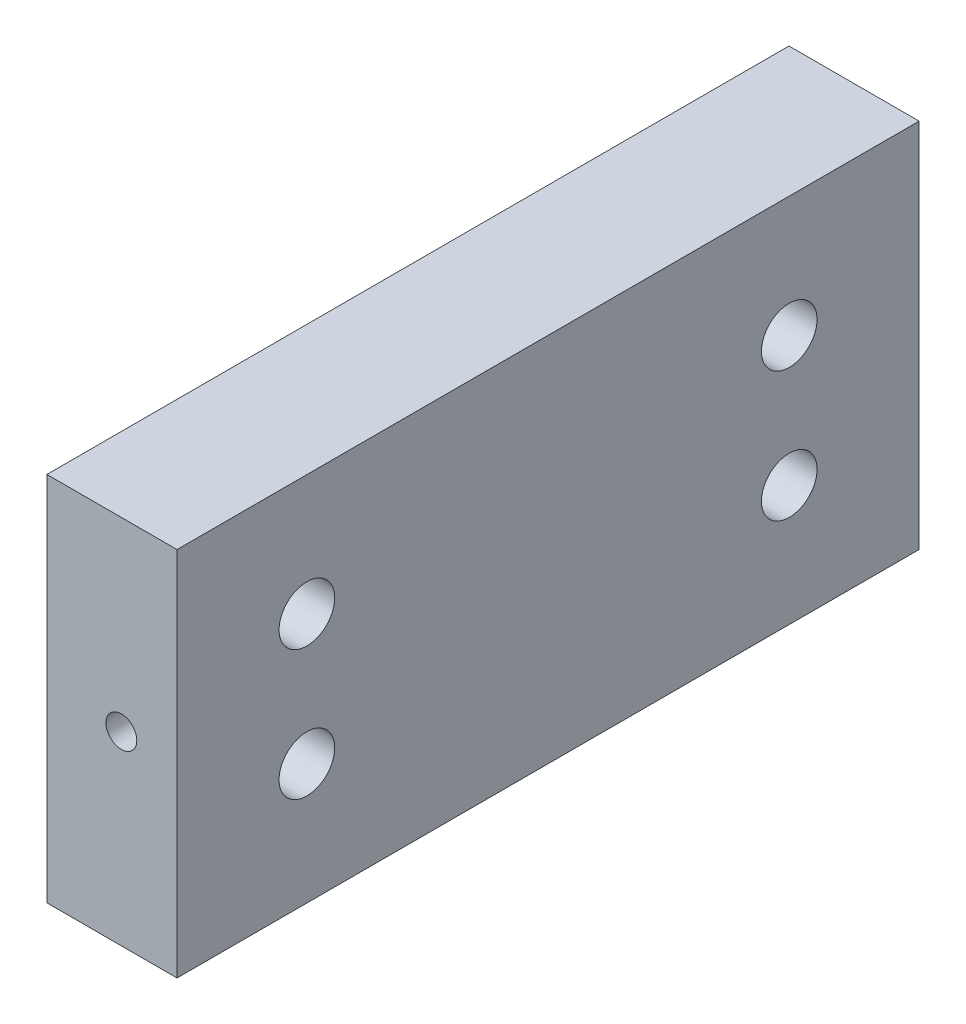
from build123d import *

# Parameters (mm, degrees)
SKIZZE1_W                                           = 35.06944
SKIZZE1_H                                           = 100
AUFSATZ_LINEAR_AUSTRAGEN1_DEPTH                     = 200
STIRNSENKUNG_F_R_M8_SENKSCHRAUBE_KOPF_B_D           = 9
STIRNSENKUNG_F_R_M8_SENKSCHRAUBE_KOPF_B_CBORE_D     = 15
STIRNSENKUNG_F_R_M8_SENKSCHRAUBE_KOPF_B_CBORE_DEPTH = 25
SPIEGELN4_COPY_1_D                                  = 9
SPIEGELN4_COPY_1_CBORE_D                            = 15
SPIEGELN4_COPY_1_CBORE_DEPTH                        = 25
KERNLOCH_F_R_M8_HELICOIL1_D                         = 8.3
KERNLOCH_F_R_M8_HELICOIL1_DEPTH                     = 20
KERNLOCH_F_R_M8_HELICOIL1_TIP                       = 2.493571569


with BuildPart() as part:
    # Skizze1 → Aufsatz-Linear austragen1 (new body)
    with BuildSketch(Plane.XY):
        Rectangle(SKIZZE1_W, SKIZZE1_H)
    extrude(amount=AUFSATZ_LINEAR_AUSTRAGEN1_DEPTH)

    # Stirnsenkung für M8 Senkschraube (Kopf Button)1 (through all)
    with Locations(Plane(origin=(17.53472, 0, 0), x_dir=(0, 0, -1), z_dir=(1, 0, 0))):
        with Locations((-165, 17.5)):
            stirnsenkung_f_r_m8_senkschraube_kopf_b = CounterBoreHole(STIRNSENKUNG_F_R_M8_SENKSCHRAUBE_KOPF_B_D / 2, STIRNSENKUNG_F_R_M8_SENKSCHRAUBE_KOPF_B_CBORE_D / 2, STIRNSENKUNG_F_R_M8_SENKSCHRAUBE_KOPF_B_CBORE_DEPTH)

    # Spiegeln3: Stirnsenkung für M8 Senkschraube (Kopf Button)1 across plane
    add(stirnsenkung_f_r_m8_senkschraube_kopf_b.mirror(Plane.XY.offset(100)), mode=Mode.SUBTRACT)

    # Spiegeln4: Stirnsenkung für M8 Senkschraube (Kopf Button)1 across plane
    add(stirnsenkung_f_r_m8_senkschraube_kopf_b.mirror(Plane.ZX), mode=Mode.SUBTRACT)

    # Spiegeln4 copy 1 (through all)
    with Locations(Plane(origin=(17.53472, 0, 200), x_dir=(0, 0, 1), z_dir=(1, 0, 0))):
        with Locations((-165, 17.5)):
            CounterBoreHole(SPIEGELN4_COPY_1_D / 2, SPIEGELN4_COPY_1_CBORE_D / 2, SPIEGELN4_COPY_1_CBORE_DEPTH)

    # Kernloch für M8 Helicoil1
    with Locations(Plane.XY.offset(200)):
        with Locations((2.53472, 0)):
            Hole(KERNLOCH_F_R_M8_HELICOIL1_D / 2, depth=KERNLOCH_F_R_M8_HELICOIL1_DEPTH)
            with Locations((0, 0, -(KERNLOCH_F_R_M8_HELICOIL1_DEPTH + KERNLOCH_F_R_M8_HELICOIL1_TIP / 2))):  # 118° drill point
                Cone(0, KERNLOCH_F_R_M8_HELICOIL1_D / 2, KERNLOCH_F_R_M8_HELICOIL1_TIP, mode=Mode.SUBTRACT)


solid = part.part
